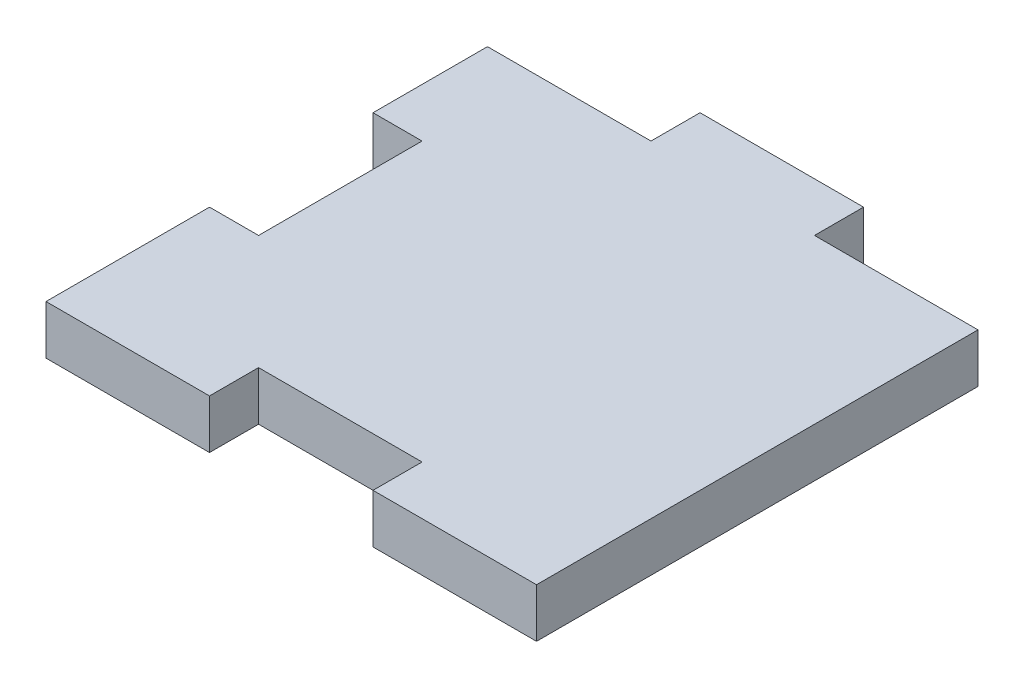
from build123d import *

# Parameters (mm, degrees)
SALIENTE_EXTRUIR1_DEPTH = 10


with BuildPart() as part:
    # Croquis1 → Saliente-Extruir1 (new body)
    with BuildSketch(Plane(origin=(0, 0, 0), x_dir=(1, 0, 0), z_dir=(0, 1, 0))):
        Polygon((-50, -16.666666667), (-50, -50), (-16.666666667, -50), (-16.666666667, -40), (16.666666667, -40), (16.666666667, -50), (50, -50), (50, 40), (16.666666667, 40), (16.666666667, 50), (-16.666666667, 50), (-16.666666667, 40), (-50, 40), (-50, 16.666666667), (-40, 16.666666667), (-40, -16.666666667), align=None)
    extrude(amount=SALIENTE_EXTRUIR1_DEPTH)


solid = part.part
